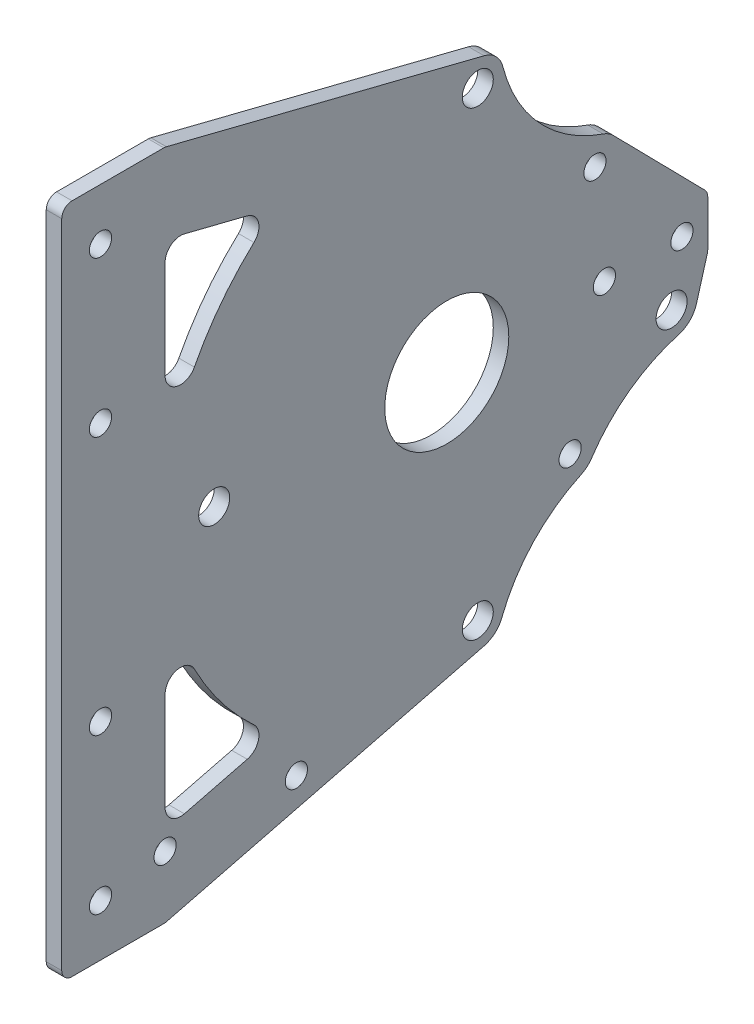
from build123d import *

# Parameters (mm, degrees)
SKETCH_1_R          = 2.15
SKETCH_1_R_2        = 12
SKETCH_1_R_3        = 3
EXTRUDE_1_DEPTH     = 3
CUT_EXTRUDE_1_DEPTH = 3
FILLET_1_R          = 2
FILLET_2_R          = 2
FILLET_3_R          = 3


with BuildPart() as part:
    # ｽｹｯﾁ1 → ﾎﾞｽ - 押し出し1 (new body)
    with BuildSketch(Plane(origin=(0, 0, 0), x_dir=(0, 0, -1), z_dir=(1, 0, 0))):
        with BuildLine():
            Line((0, 0), (20, 0))
            Line((20, 0), (81.721631315, 15.55153458))
            ThreePointArc((81.721631315, 15.55153458), (83.805915962, 16.648877548), (85.156498305, 18.57873024))
            ThreePointArc((85.156498305, 18.57873024), (91.240951268, 28.202978223), (100.473591964, 34.86669062))
            ThreePointArc((100.473591964, 34.86669062), (101.625387424, 35.607613327), (102.53294649, 36.633252532))
            ThreePointArc((102.53294649, 36.633252532), (109.848876527, 44.266796828), (119.358709974, 48.888149295))
            ThreePointArc((119.358709974, 48.888149295), (121.530071674, 50.159012288), (122.807632728, 52.326439826))
            Line((122.807632728, 52.326439826), (125, 60))
            Line((125, 60), (125, 70))
            Line((125, 70), (106.736076333, 88.580227744))
            ThreePointArc((106.736076333, 88.580227744), (105.828986144, 89.309735766), (104.777796911, 89.809731531))
            ThreePointArc((104.777796911, 89.809731531), (92.392887273, 97.853140314), (85.346092725, 110.831009869))
            ThreePointArc((85.346092725, 110.831009869), (84.032111964, 113.138952539), (81.721631315, 114.44846542))
            Line((81.721631315, 114.44846542), (20, 130))
            Line((20, 130), (0, 130))
            Line((0, 130), (0, 0))
        make_face()
        with Locations((7.5, 120)):
            Circle(SKETCH_1_R, mode=Mode.SUBTRACT)
        with Locations((7.5, 90)):
            Circle(SKETCH_1_R, mode=Mode.SUBTRACT)
        with Locations(Location((7.5, 40, 0), (0, 0, 180))):
            Circle(SKETCH_1_R, mode=Mode.SUBTRACT)
        with Locations(Location((7.5, 10, 0), (0, 0, 180))):
            Circle(SKETCH_1_R, mode=Mode.SUBTRACT)
        with Locations((74.5, 65)):
            Circle(SKETCH_1_R_2, mode=Mode.SUBTRACT)
        with Locations((29.5, 65)):
            Circle(SKETCH_1_R_3, mode=Mode.SUBTRACT)
        with Locations((80.5, 20.4)):
            Circle(SKETCH_1_R_3, mode=Mode.SUBTRACT)
        with Locations((118, 53.7)):
            Circle(SKETCH_1_R_3, mode=Mode.SUBTRACT)
        with Locations((80.5, 109.6)):
            Circle(SKETCH_1_R_3, mode=Mode.SUBTRACT)
        with Locations((103.17032155, 85.075175272)):
            Circle(SKETCH_1_R, mode=Mode.SUBTRACT)
        with Locations((98.369942602, 39.402620443)):
            Circle(SKETCH_1_R, mode=Mode.SUBTRACT)
        with Locations((105, 65)):
            Circle(SKETCH_1_R, mode=Mode.SUBTRACT)
        with Locations((120, 65)):
            Circle(SKETCH_1_R, mode=Mode.SUBTRACT)
        with Locations((20, 12)):
            Circle(SKETCH_1_R, mode=Mode.SUBTRACT)
        with Locations((45.4, 12)):
            Circle(SKETCH_1_R, mode=Mode.SUBTRACT)
    extrude(amount=EXTRUDE_1_DEPTH)

    # ｽｹｯﾁ2 → ｶｯﾄ - 押し出し1 (cut)
    with BuildSketch(Plane(origin=(3, 0, 0), x_dir=(0, 0, -1), z_dir=(1, 0, 0))):
        with BuildLine():
            Line((20, 114.531188015), (20, 72.399324293))
            ThreePointArc((20, 72.399324293), (27.112840869, 92.918759813), (41.614001532, 109.085270837))
            Line((41.614001532, 109.085270837), (20, 114.531188015))
        make_face()
        with BuildLine():
            Line((20, 15.468811985), (41.614001532, 20.914729163))
            ThreePointArc((41.614001532, 20.914729163), (27.112840869, 37.081240187), (20, 57.600675707))
            Line((20, 57.600675707), (20, 15.468811985))
        make_face()
    extrude(amount=-CUT_EXTRUDE_1_DEPTH, mode=Mode.SUBTRACT)

    # ﾌｨﾚｯﾄ1
    fillet_1_edges = [part.edges().sort_by_distance(p)[0] for p in [
        (1.5, 130, 0),
        (1.5, 130, -20),
        (1.5, 0, -20),
        (1.5, 0, 0),
    ]]
    fillet(fillet_1_edges, radius=FILLET_1_R)

    # ﾌｨﾚｯﾄ2
    fillet_2_edges = [part.edges().sort_by_distance(p)[0] for p in [
        (1.5, 70, -125),
        (1.5, 60, -125),
    ]]
    fillet(fillet_2_edges, radius=FILLET_2_R)

    # ﾌｨﾚｯﾄ3
    fillet_3_edges = [part.edges().sort_by_distance(p)[0] for p in [
        (1.5, 114.531188015, -20),
        (1.5, 109.085270837, -41.614001532),
        (1.5, 72.399324293, -20),
        (1.5, 15.468811985, -20),
        (1.5, 57.600675707, -20),
        (1.5, 20.914729163, -41.614001532),
    ]]
    fillet(fillet_3_edges, radius=FILLET_3_R)


solid = part.part
